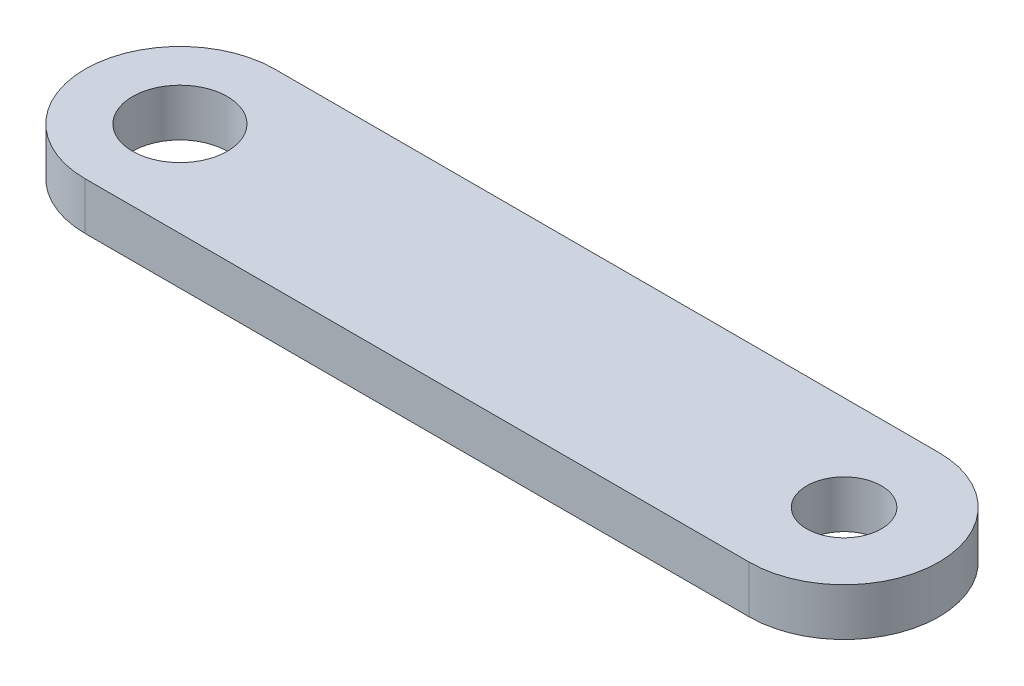
from build123d import *

# Parameters (mm, degrees)
SKETCH1_R           = 3.175
SKETCH1_R_2         = 2.5
BOSS_EXTRUDE1_DEPTH = 3.175


with BuildPart() as part:
    # Sketch1 → Boss-Extrude1 (new body)
    with BuildSketch(Plane(origin=(0, 0, 0), x_dir=(1, 0, 0), z_dir=(0, 1, 0))):
        with BuildLine():
            Line((0, 6.35), (44.45, 6.35))
            ThreePointArc((44.45, 6.35), (50.8, 0), (44.45, -6.35))
            Line((44.45, -6.35), (0, -6.35))
            ThreePointArc((0, -6.35), (-6.35, 0), (0, 6.35))
        make_face()
        with Locations(Location((0, 0, 0), (0, 0, 270))):
            Circle(SKETCH1_R, mode=Mode.SUBTRACT)
        with Locations(Location((44.45, 0, 0), (0, 0, 270))):
            Circle(SKETCH1_R_2, mode=Mode.SUBTRACT)
    extrude(amount=BOSS_EXTRUDE1_DEPTH)


solid = part.part
